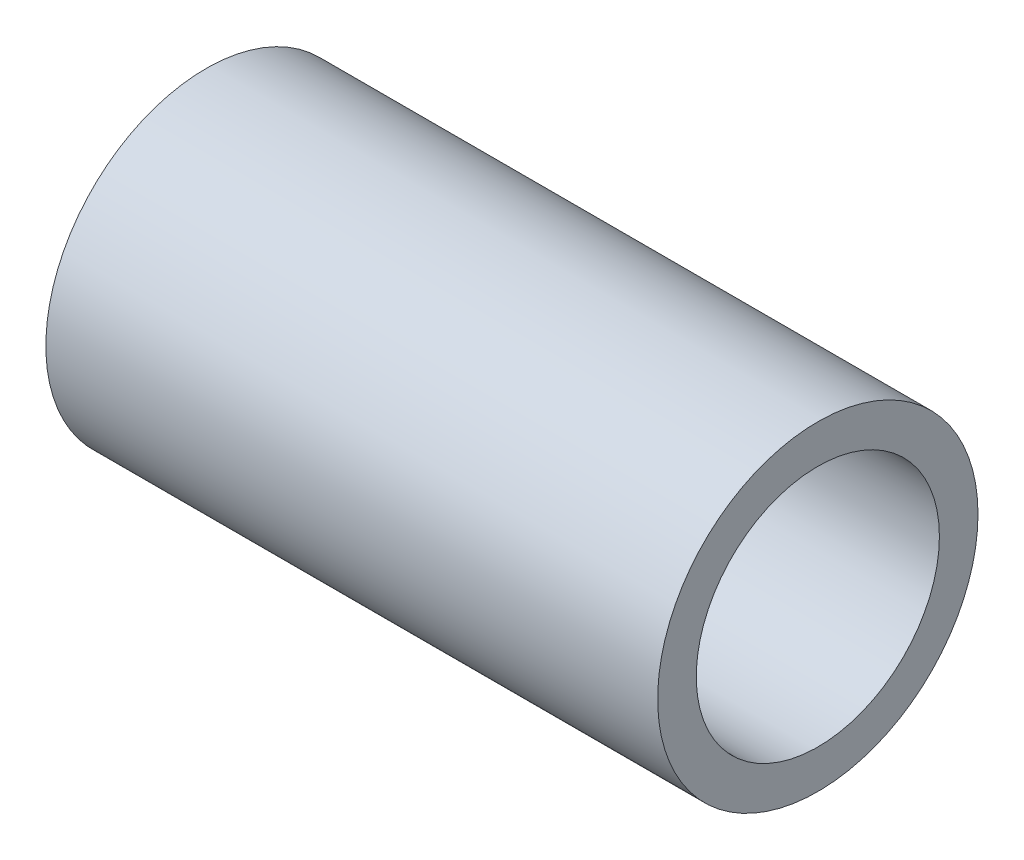
from build123d import *

# Parameters (mm, degrees)
SKETCH1_R      = 13.175
SKETCH1_R_2    = 10
EXTRUDE1_DEPTH = 50.325


with BuildPart() as part:
    # Sketch1 → Extrude1 (new body)
    with BuildSketch(Plane(origin=(0, 0, 0), x_dir=(0, 0, -1), z_dir=(1, 0, 0))):
        Circle(SKETCH1_R)
        Circle(SKETCH1_R_2, mode=Mode.SUBTRACT)
    extrude(amount=EXTRUDE1_DEPTH)


solid = part.part
